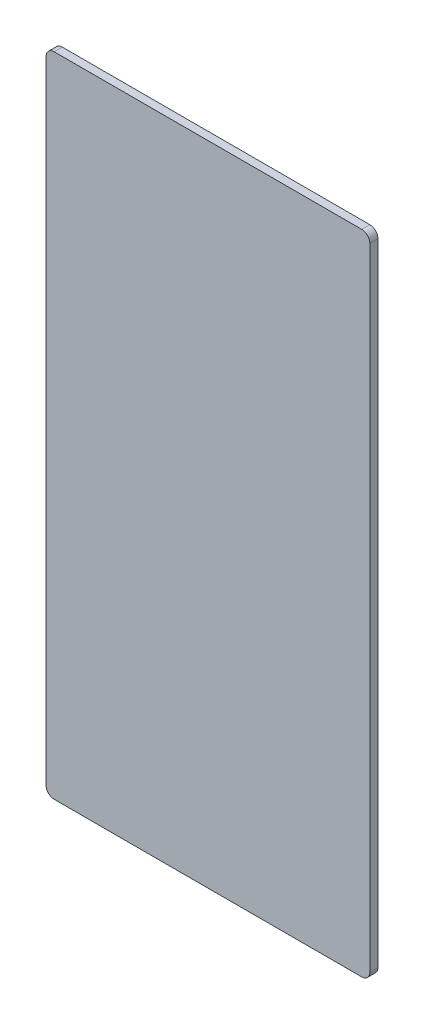
from build123d import *

# Parameters (mm, degrees)
SKETCH2_W           = 20
SKETCH2_H           = 40
BOSS_EXTRUDE1_DEPTH = 0.5
SKETCH4_W           = 18
SKETCH4_H           = 38
BOSS_EXTRUDE2_DEPTH = 0.5
FILLET1_R           = 0.5


with BuildPart() as part:
    # Sketch2 → Boss-Extrude1 (new body)
    with BuildSketch(Plane.XY):
        Rectangle(SKETCH2_W, SKETCH2_H)
    extrude(amount=BOSS_EXTRUDE1_DEPTH)

    # Sketch4 → Boss-Extrude2 (add)
    with BuildSketch(Plane(origin=(0, 0, 0), x_dir=(-1, 0, 0), z_dir=(0, 0, -1))):
        Rectangle(SKETCH4_W, SKETCH4_H)
    extrude(amount=BOSS_EXTRUDE2_DEPTH)

    # Fillet1
    fillet1_edges = [part.edges().sort_by_distance(p)[0] for p in [
        (10, -20, 0.25),
        (-10, -20, 0.25),
        (-10, 20, 0.25),
        (10, 20, 0.25),
    ]]
    fillet(fillet1_edges, radius=FILLET1_R)


solid = part.part
